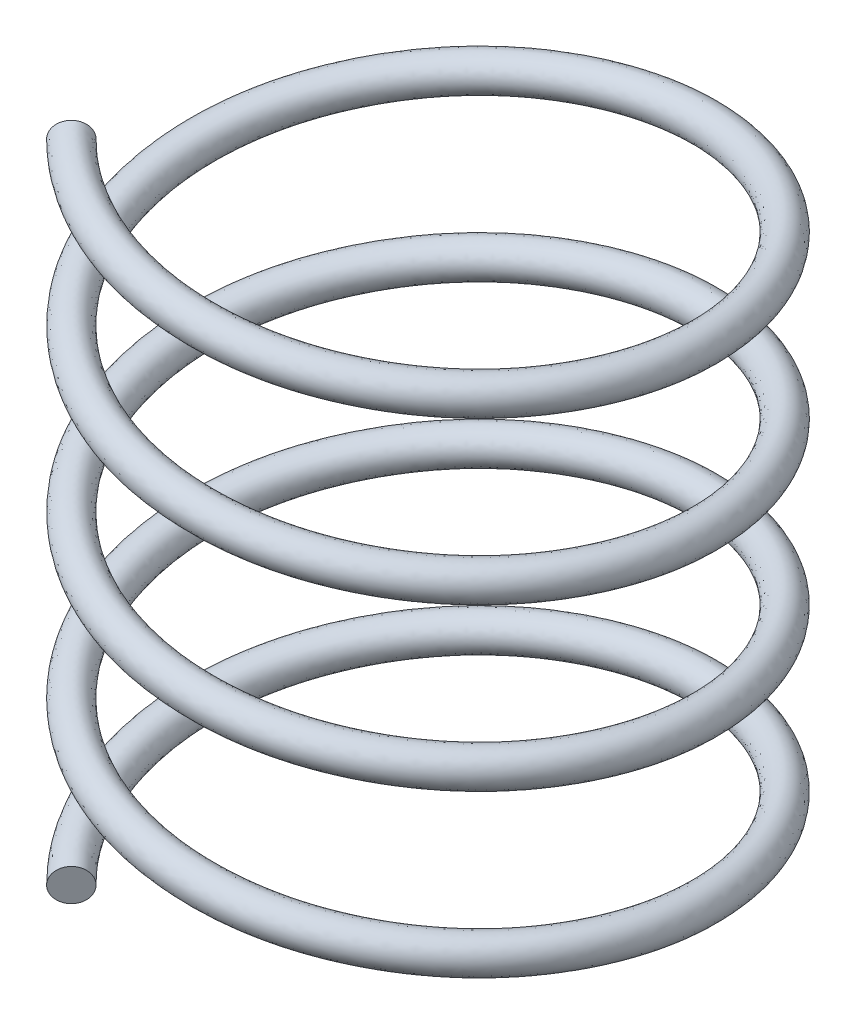
from build123d import *

# Parameters (mm, degrees)
SWEEP1_PITCH       = 3
SWEEP1_HEIGHT      = 12
SWEEP1_RADIUS      = 4.675
SWEEP1_START_ANGLE = -45
SKETCH4_R          = 0.325


with BuildPart() as part:
    # Sweep1: sweep along a helix
    with BuildLine() as sweep1_path:
        add(Helix(SWEEP1_PITCH, SWEEP1_HEIGHT, SWEEP1_RADIUS, center=(0, 0, 0), direction=(0, 1, 0), lefthand=True, mode=Mode.PRIVATE).rotate(Axis((0, 0, 0), (0, 1, 0)), SWEEP1_START_ANGLE))
    # Sketch4 → Sweep1 (sweep)
    with BuildSketch(Plane(origin=(-3.305724202, 0, 3.305724202), x_dir=(-0.6962228145706657, 0.10055948015595484, 0.7107472007838403), z_dir=(-0.7034475222630039, 0.1016029863936357, -0.7034475222629869))):
        with Locations((0.00928562, 0.003561064)):
            Circle(SKETCH4_R)
    sweep(path=sweep1_path.line, is_frenet=True)


solid = part.part
